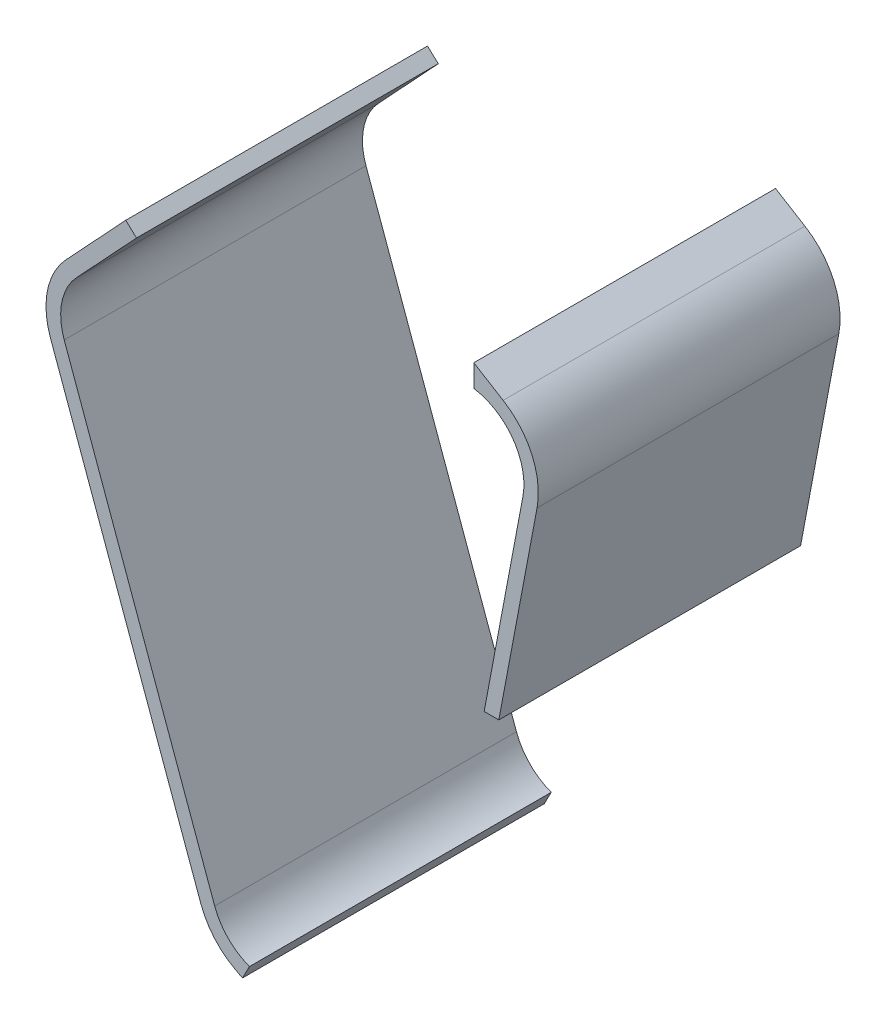
from build123d import *

# Parameters (mm, degrees)
EXTRUDE_1_DEPTH   = 205.6
EXTRUDE_1_2_DEPTH = 205.6


with BuildPart() as part:
    # 草图1 → 凸台-拉伸1 (new body)
    with BuildSketch(Plane.XY):
        with BuildLine():
            Line((-8.995494076, 185.326700571), (1.004505924, 185.326700571))
            Line((1.004505924, 185.326700571), (27.04342469, 323.406049026))
            ThreePointArc((27.04342469, 323.406049026), (23.5960153, 352.98764851), (3.939822245, 375.361511256))
            Line((3.939822245, 375.361511256), (-16.060177755, 387.55663496))
            Line((-16.060177755, 387.55663496), (-16.060177755, 372.389722306))
            ThreePointArc((-16.060177755, 372.389722306), (10.678605878, 355.911082125), (17.386834148, 325.227082942))
            Line((17.386834148, 325.227082942), (-8.995494076, 185.326700571))
        make_face()
    extrude(amount=EXTRUDE_1_DEPTH)


with BuildPart() as body_2:
    # 草图1 → Extrude 1 2 (new body)
    with BuildSketch(Plane.XY):
        with BuildLine():
            Line((-173.638339805, -54.26465335), (-168.877472349, -45.115490849))
            ThreePointArc((-168.877472349, -45.115490849), (-183.370602204, -35.793508136), (-192.597121359, -21.239418711))
            Line((-192.597121359, -21.239418711), (-295.118607687, 261.458792952))
            ThreePointArc((-295.118607687, 261.458792952), (-296.707501188, 283.092676983), (-286.770141016, 302.374751396))
            Line((-286.770141016, 302.374751396), (-245.851813515, 346.257441315))
            Line((-245.851813515, 346.257441315), (-253.165595168, 353.077162565))
            Line((-253.165595168, 353.077162565), (-294.083922669, 309.194472646))
            ThreePointArc((-294.083922669, 309.194472646), (-306.505622885, 285.09187963), (-304.519506008, 258.049524591))
            Line((-304.519506008, 258.049524591), (-201.99801968, -24.648687072))
            ThreePointArc((-201.99801968, -24.648687072), (-192.602015595, -40.550815133), (-178.073768212, -51.956629336))
            Line((-178.073768212, -51.956629336), (-173.638339805, -54.26465335))
        make_face()
    extrude(amount=EXTRUDE_1_2_DEPTH)


solid = Compound([part.part, body_2.part])
